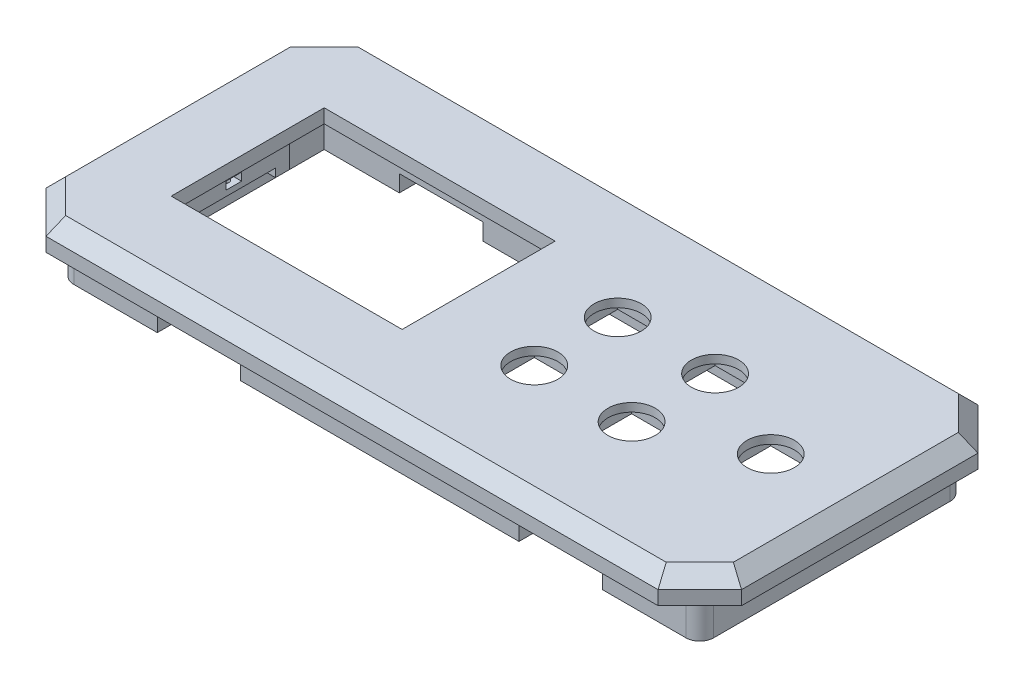
from build123d import *

# Parameters (mm, degrees)
SKETCH1_W                = 250
SKETCH1_H                = 115
SKETCH1_R                = 8.5
SKETCH1_W_2              = 83
SKETCH1_H_2              = 55
BOSS_EXTRUDE1_DEPTH      = 10
SKETCH2_W                = 230
SKETCH2_H                = 95
SKETCH2_W_2              = 214
SKETCH2_H_2              = 79
BOSS_EXTRUDE2_DEPTH      = 15
SKETCH3_W                = 25
SKETCH3_H                = 25
CUT_EXTRUDE1_DEPTH       = 7
SKETCH4_W                = 93
SKETCH4_H                = 65
SKETCH4_W_2              = 83
SKETCH4_H_2              = 55
CUT_EXTRUDE2_DEPTH       = 5
SKETCH5_W                = 7
SKETCH5_H                = 5
SKETCH5_W_2              = 10
BOSS_EXTRUDE3_DEPTH      = 8
SKETCH7_W                = 7
SKETCH7_H                = 30
SKETCH7_W_2              = 10
BOSS_EXTRUDE4_DEPTH      = 5
SKETCH8_W                = 5.6
SKETCH8_H                = 2.8
CUT_EXTRUDE7_DEPTH       = 6.6
SKETCH9_W                = 5.6
SKETCH9_H                = 2.8
CUT_EXTRUDE8_DEPTH       = 6.6
CUT_EXTRUDE9_DEPTH       = 139.38457284
CUT_EXTRUDE9_DEPTH_BACK  = 139.38457284
SKETCH10_R               = 1.65
SKETCH11_R               = 1.65
BOSS_EXTRUDE5_DEPTH      = 3
SKETCH12_W               = 10
SKETCH12_H               = 0.5
CUT_EXTRUDE10_DEPTH      = 3
SKETCH13_W               = 30
SKETCH13_H               = 8
CUT_EXTRUDE11_DEPTH      = 6
SKETCH14_W               = 5.6
SKETCH14_H               = 2.8
CUT_EXTRUDE12_DEPTH      = 6.6
CUT_EXTRUDE13_DEPTH      = 139.222610307
CUT_EXTRUDE13_DEPTH_BACK = 139.222610307
SKETCH15_R               = 1.65
SKETCH16_W               = 5.6
SKETCH16_H               = 2.8
CUT_EXTRUDE14_DEPTH      = 6.6
CUT_EXTRUDE15_DEPTH      = 139.222610307
CUT_EXTRUDE15_DEPTH_BACK = 139.222610307
SKETCH17_R               = 1.65
SKETCH18_R               = 1.65
BOSS_EXTRUDE6_DEPTH      = 4
CHAMFER1_SIZE            = 15
CHAMFER2_SIZE            = 5
FILLET1_R                = 5


with BuildPart() as part:
    # Sketch1 → Boss-Extrude1 (new body)
    with BuildSketch(Plane(origin=(0, 0, 0), x_dir=(1, 0, 0), z_dir=(0, 1, 0))):
        Rectangle(SKETCH1_W, SKETCH1_H)
        with Locations(Location((23, 15, 0), (0, 0, 270))):
            Circle(SKETCH1_R, mode=Mode.SUBTRACT)
        with Locations(Location((58, 15, 0), (0, 0, 270))):
            Circle(SKETCH1_R, mode=Mode.SUBTRACT)
        with Locations(Location((23, -15, 0), (0, 0, 270))):
            Circle(SKETCH1_R, mode=Mode.SUBTRACT)
        with Locations(Location((58, -15, 0), (0, 0, 270))):
            Circle(SKETCH1_R, mode=Mode.SUBTRACT)
        with Locations(Location((93, 0, 0), (0, 0, 270))):
            Circle(SKETCH1_R, mode=Mode.SUBTRACT)
        with Locations((-53.5, 0)):
            Rectangle(SKETCH1_W_2, SKETCH1_H_2, mode=Mode.SUBTRACT)
    extrude(amount=BOSS_EXTRUDE1_DEPTH)

    # Sketch2 → Boss-Extrude2 (add)
    with BuildSketch(Plane.XZ):
        Rectangle(SKETCH2_W, SKETCH2_H)
        Rectangle(SKETCH2_W_2, SKETCH2_H_2, mode=Mode.SUBTRACT)
    extrude(amount=BOSS_EXTRUDE2_DEPTH)

    # Sketch3 → Cut-Extrude1 (cut)
    with BuildSketch(Plane.XZ):
        with Locations((23, 15)):
            Rectangle(SKETCH3_W, SKETCH3_H)
        with Locations((58, 15)):
            Rectangle(SKETCH3_W, SKETCH3_H)
        with Locations((23, -15)):
            Rectangle(SKETCH3_W, SKETCH3_H)
        with Locations((58, -15)):
            Rectangle(SKETCH3_W, SKETCH3_H)
        with Locations((93, 0)):
            Rectangle(SKETCH3_W, SKETCH3_H)
    extrude(amount=-CUT_EXTRUDE1_DEPTH, mode=Mode.SUBTRACT)

    # Sketch4 → Cut-Extrude2 (cut)
    with BuildSketch(Plane.XZ):
        with Locations((-53.5, 0)):
            Rectangle(SKETCH4_W, SKETCH4_H)
        with Locations((-53.5, 0)):
            Rectangle(SKETCH4_W_2, SKETCH4_H_2, mode=Mode.SUBTRACT)
    extrude(amount=-CUT_EXTRUDE2_DEPTH, mode=Mode.SUBTRACT)

    # Sketch5 → Boss-Extrude3 (add)
    with BuildSketch(Plane.XZ):
        with Locations((-103.5, 17.5)):
            Rectangle(SKETCH5_W, SKETCH5_H)
        with Locations((-103.5, -17.5)):
            Rectangle(SKETCH5_W, SKETCH5_H)
        with Locations((-2, 17.853765276)):
            Rectangle(SKETCH5_W_2, SKETCH5_H)
        with Locations((-2, -17.146234724)):
            Rectangle(SKETCH5_W_2, SKETCH5_H)
    extrude(amount=BOSS_EXTRUDE3_DEPTH)

    # Sketch7 → Boss-Extrude4 (add)
    with BuildSketch(Plane.XZ):
        with Locations((-103.5, 0)):
            Rectangle(SKETCH7_W, SKETCH7_H)
        with Locations((-2, 0.353765276)):
            Rectangle(SKETCH7_W_2, SKETCH7_H)
    extrude(amount=BOSS_EXTRUDE4_DEPTH)

    # Sketch8 → Cut-Extrude7 (cut)
    with BuildSketch(Plane.ZY.offset(7)):
        with Locations((0, -1.6)):
            Rectangle(SKETCH8_W, SKETCH8_H)
    extrude(amount=-CUT_EXTRUDE7_DEPTH, mode=Mode.SUBTRACT)

    # Sketch9 → Cut-Extrude8 (cut)
    with BuildSketch(Plane(origin=(-100, 0, 0), x_dir=(0, 0, -1), z_dir=(1, 0, 0))):
        with Locations((0, -1.6)):
            Rectangle(SKETCH9_W, SKETCH9_H)
    extrude(amount=-CUT_EXTRUDE8_DEPTH, mode=Mode.SUBTRACT)

    # Sketch10 → Cut-Extrude9 (cut, two sides: drawn at the far end of the back side and taken through both)
    with BuildSketch(Plane.XZ.offset(0.2).offset(-CUT_EXTRUDE9_DEPTH_BACK)):
        with Locations(Location((-3.7, 0, 0), (0, 0, 270))):
            Circle(SKETCH10_R)
        with Locations(Location((-103.478401375, 0, 0), (0, 0, 270))):
            Circle(SKETCH10_R)
    extrude(amount=CUT_EXTRUDE9_DEPTH + CUT_EXTRUDE9_DEPTH_BACK, mode=Mode.SUBTRACT)

    # Sketch11 → Boss-Extrude5 (add)
    with BuildSketch(Plane(origin=(0, 10, 0), x_dir=(1, 0, 0), z_dir=(0, 1, 0))):
        with Locations(Location((-3.7, 0, 0), (0, 0, 270))):
            Circle(SKETCH11_R)
        with Locations(Location((-103.478401375, 0, 0), (0, 0, 270))):
            Circle(SKETCH11_R)
    extrude(amount=-BOSS_EXTRUDE5_DEPTH)

    # Sketch12 → Cut-Extrude10 (cut)
    with BuildSketch(Plane.XZ.offset(8)):
        with Locations((-2, -14.896234724)):
            Rectangle(SKETCH12_W, SKETCH12_H)
    extrude(amount=-CUT_EXTRUDE10_DEPTH, mode=Mode.SUBTRACT)

    # Sketch13 → Cut-Extrude11 (cut)
    with BuildSketch(Plane.XZ.offset(15)):
        with Locations((-65, 43.5)):
            Rectangle(SKETCH13_W, SKETCH13_H)
        with Locations((65, 43.5)):
            Rectangle(SKETCH13_W, SKETCH13_H)
        with Locations((-65, -43.5)):
            Rectangle(SKETCH13_W, SKETCH13_H)
        with Locations((65, -43.5)):
            Rectangle(SKETCH13_W, SKETCH13_H)
    extrude(amount=-CUT_EXTRUDE11_DEPTH, mode=Mode.SUBTRACT)

    # Sketch14 → Cut-Extrude12 (cut)
    with BuildSketch(Plane.XY.offset(47.5)):
        with Locations((-65, -4.6)):
            Rectangle(SKETCH14_W, SKETCH14_H)
        with Locations((65, -4.6)):
            Rectangle(SKETCH14_W, SKETCH14_H)
    extrude(amount=-CUT_EXTRUDE12_DEPTH, mode=Mode.SUBTRACT)

    # Sketch15 → Cut-Extrude13 (cut, two sides: drawn at the far end of the back side and taken through both)
    with BuildSketch(Plane.XZ.offset(3.2).offset(-CUT_EXTRUDE13_DEPTH_BACK)):
        with Locations(Location((-65, 44.2, 0), (0, 0, 270))):
            Circle(SKETCH15_R)
        with Locations(Location((65, 44.2, 0), (0, 0, 270))):
            Circle(SKETCH15_R)
    extrude(amount=CUT_EXTRUDE13_DEPTH + CUT_EXTRUDE13_DEPTH_BACK, mode=Mode.SUBTRACT)

    # Sketch16 → Cut-Extrude14 (cut)
    with BuildSketch(Plane(origin=(0, 0, -47.5), x_dir=(-1, 0, 0), z_dir=(0, 0, -1))):
        with Locations((-65, -4.6)):
            Rectangle(SKETCH16_W, SKETCH16_H)
        with Locations((65, -4.6)):
            Rectangle(SKETCH16_W, SKETCH16_H)
    extrude(amount=-CUT_EXTRUDE14_DEPTH, mode=Mode.SUBTRACT)

    # Sketch17 → Cut-Extrude15 (cut, two sides: drawn at the far end of the back side and taken through both)
    with BuildSketch(Plane.XZ.offset(3.2).offset(-CUT_EXTRUDE15_DEPTH_BACK)):
        with Locations(Location((65, -44.2, 0), (0, 0, 270))):
            Circle(SKETCH17_R)
        with Locations(Location((-65, -43.998374959, 0), (0, 0, 270))):
            Circle(SKETCH17_R)
    extrude(amount=CUT_EXTRUDE15_DEPTH + CUT_EXTRUDE15_DEPTH_BACK, mode=Mode.SUBTRACT)

    # Sketch18 → Boss-Extrude6 (add)
    with BuildSketch(Plane(origin=(0, 10, 0), x_dir=(1, 0, 0), z_dir=(0, 1, 0))):
        with Locations(Location((-65, 43.998374959, 0), (0, 0, 270))):
            Circle(SKETCH18_R)
        with Locations(Location((65, 44.2, 0), (0, 0, 270))):
            Circle(SKETCH18_R)
        with Locations(Location((-65, -44.2, 0), (0, 0, 270))):
            Circle(SKETCH18_R)
        with Locations(Location((65, -44.2, 0), (0, 0, 270))):
            Circle(SKETCH18_R)
    extrude(amount=-BOSS_EXTRUDE6_DEPTH)

    # Chamfer1
    chamfer1_edges = [part.edges().sort_by_distance(p)[0] for p in [
        (125, 5, 57.5),
        (-125, 5, 57.5),
        (-125, 5, -57.5),
        (125, 5, -57.5),
    ]]
    chamfer(chamfer1_edges, length=CHAMFER1_SIZE)

    # Chamfer2
    chamfer2_edges = [part.edges().sort_by_distance(p)[0] for p in [
        (-125, 10, 0),
        (0, 10, -57.5),
        (125, 10, 0),
        (0, 10, 57.5),
        (-117.5, 10, 50),
        (117.5, 10, 50),
        (117.5, 10, -50),
        (-117.5, 10, -50),
    ]]
    chamfer(chamfer2_edges, length=CHAMFER2_SIZE)

    # Fillet1
    fillet1_edges = [part.edges().sort_by_distance(p)[0] for p in [
        (115, -7.5, -47.5),
        (115, -7.5, 47.5),
        (-115, -7.5, 47.5),
        (-115, -7.5, -47.5),
    ]]
    fillet(fillet1_edges, radius=FILLET1_R)


solid = part.part
